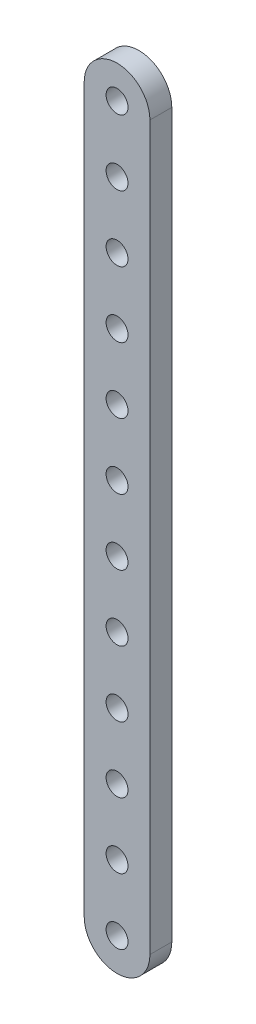
from build123d import *

# Parameters (mm, degrees)
MODEL_R                 = 1.5
SALIENTE_EXTRUIR1_DEPTH = 3


with BuildPart() as part:
    # Model → Saliente-Extruir1 (new body)
    with BuildSketch(Plane.XY):
        with BuildLine():
            Line((213.25077615, 89.428489513), (213.25077615, 188.428489513))
            ThreePointArc((213.25077615, 188.428489513), (208.75077615, 192.928489513), (204.25077615, 188.428489513))
            Line((204.25077615, 188.428489513), (204.25077615, 89.428489513))
            ThreePointArc((204.25077615, 89.428489513), (208.75077615, 84.928489513), (213.25077615, 89.428489513))
        make_face()
        with Locations((208.75077615, 179.428489513)):
            Circle(MODEL_R, mode=Mode.SUBTRACT)
        with Locations((208.75077615, 188.428489513)):
            Circle(MODEL_R, mode=Mode.SUBTRACT)
        with Locations((208.75077615, 152.428489513)):
            Circle(MODEL_R, mode=Mode.SUBTRACT)
        with Locations((208.75077615, 161.428489513)):
            Circle(MODEL_R, mode=Mode.SUBTRACT)
        with Locations((208.75077615, 170.428489513)):
            Circle(MODEL_R, mode=Mode.SUBTRACT)
        with Locations((208.75077615, 143.428489513)):
            Circle(MODEL_R, mode=Mode.SUBTRACT)
        with Locations((208.75077615, 116.428489513)):
            Circle(MODEL_R, mode=Mode.SUBTRACT)
        with Locations((208.75077615, 125.428489513)):
            Circle(MODEL_R, mode=Mode.SUBTRACT)
        with Locations((208.75077615, 134.428489513)):
            Circle(MODEL_R, mode=Mode.SUBTRACT)
        with Locations((208.75077615, 89.428489513)):
            Circle(MODEL_R, mode=Mode.SUBTRACT)
        with Locations((208.75077615, 98.428489513)):
            Circle(MODEL_R, mode=Mode.SUBTRACT)
        with Locations((208.75077615, 107.428489513)):
            Circle(MODEL_R, mode=Mode.SUBTRACT)
    extrude(amount=SALIENTE_EXTRUIR1_DEPTH)


solid = part.part
